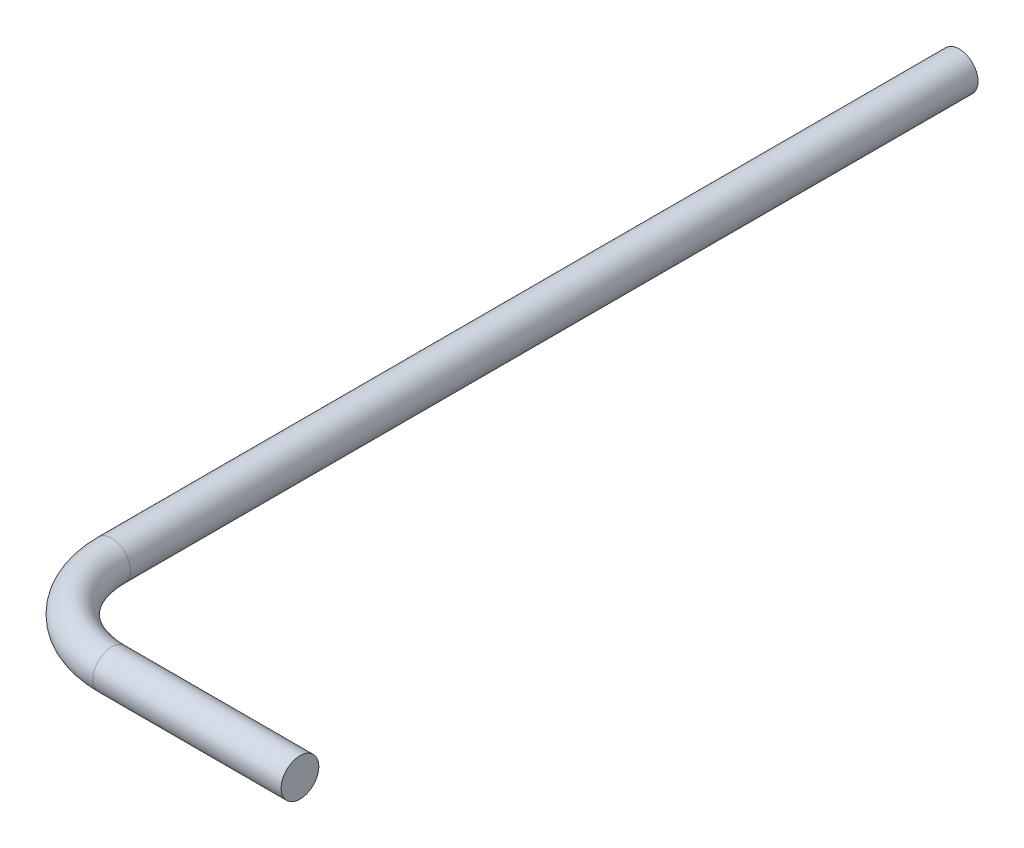
from build123d import *

# Parameters (mm, degrees)
SWEEP1_PROFILE_R = 2


with BuildPart() as part:
    # Sweep1: sweep along a path in Sketch2
    with BuildLine(Plane(origin=(0, 0, 0), x_dir=(1, 0, 0), z_dir=(0, 1, 0))) as sweep1_path:
        Line((0, 0), (-20, 0))
        ThreePointArc((-20, 0), (-27.071067812, 2.928932188), (-30, 10))
        Line((-30, 10), (-30, 100))
    # Sweep1 profile (on start of the path) → Sweep1 (sweep)
    with BuildSketch(Plane(origin=(0, 0, 0), x_dir=(0, 0, -1), z_dir=(-1, 0, 0))):
        Circle(SWEEP1_PROFILE_R)
    sweep(path=sweep1_path.line)


solid = part.part
